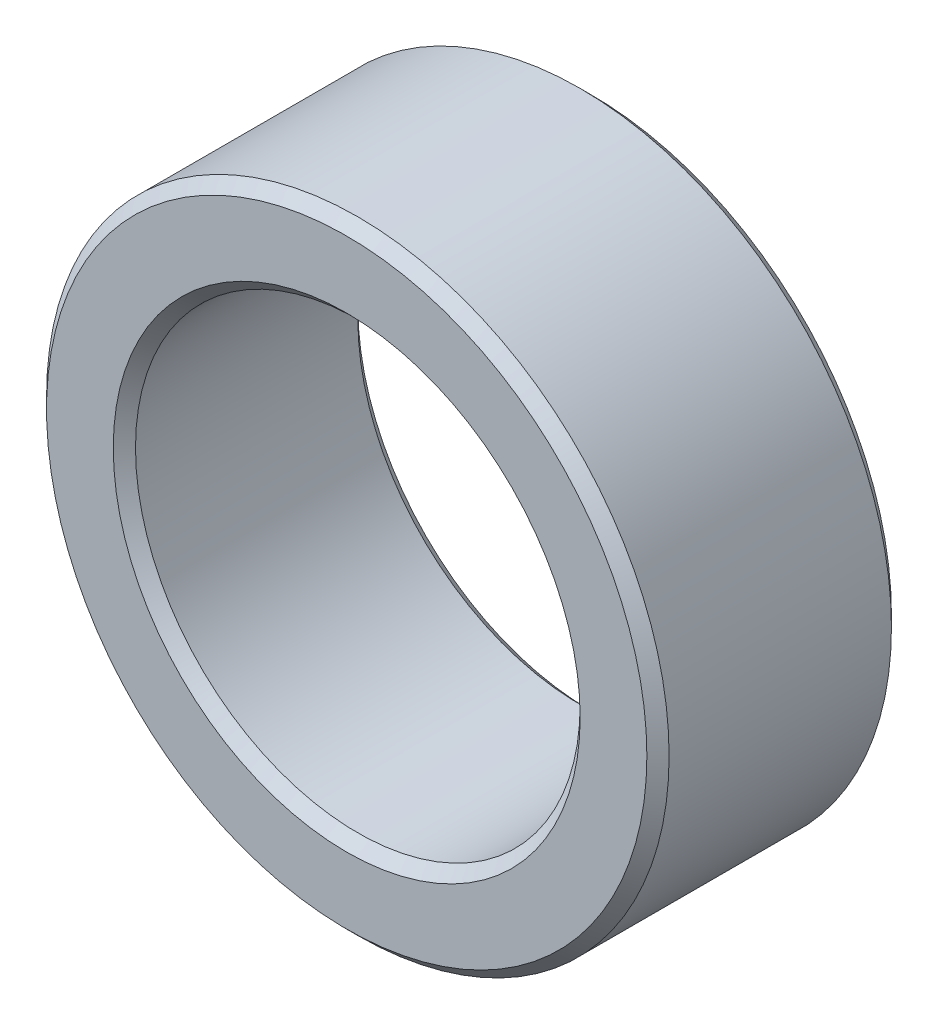
from build123d import *

# Parameters (mm, degrees)
BK_COLLAR_SKETCH_R     = 7
BK_COLLAR_SKETCH_R_2   = 5
BK_COLLAR_DEPTH        = 5.5
BK_COLLAR_CHAMFER_SIZE = 0.25


with BuildPart() as part:
    # BK Collar Sketch → BK Collar (new body)
    with BuildSketch(Plane.XY):
        Circle(BK_COLLAR_SKETCH_R)
        Circle(BK_COLLAR_SKETCH_R_2, mode=Mode.SUBTRACT)
    extrude(amount=BK_COLLAR_DEPTH)

    # BK Collar Chamfer
    bk_collar_chamfer_edges = [part.edges().sort_by_distance(p)[0] for p in [
        (-7, 0, 0),
        (-7, 0, 5.5),
        (-5, 0, 0),
        (-5, 0, 5.5),
    ]]
    chamfer(bk_collar_chamfer_edges, length=BK_COLLAR_CHAMFER_SIZE)


solid = part.part
